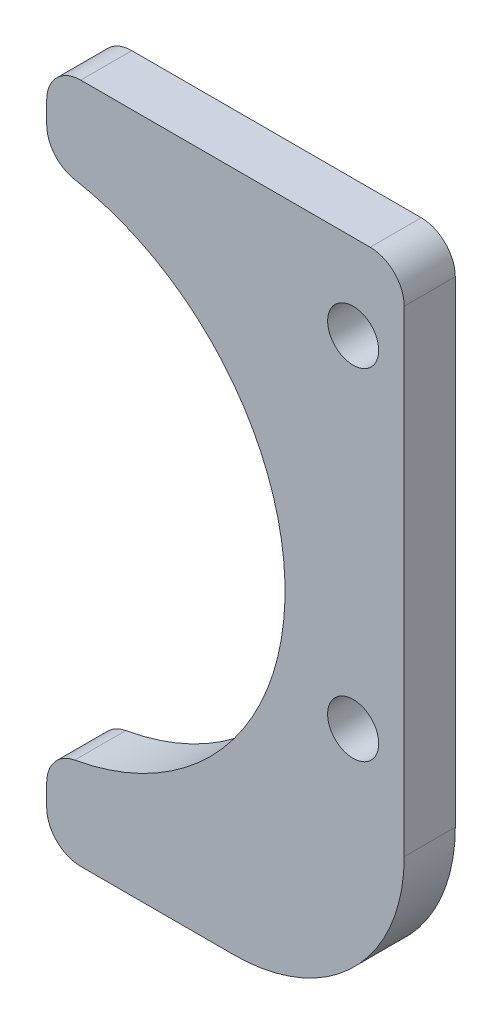
from build123d import *

# Parameters (mm, degrees)
EXTRUDE_1_DEPTH     = 3
SKETCH_2_R          = 1.5
CUT_EXTRUDE_1_DEPTH = 30.883105595
FILLET_1_R          = 10
FILLET_2_R          = 2


with BuildPart() as part:
    # 草图1 → 凸台-拉伸1 (new body)
    with BuildSketch(Plane.XY):
        with BuildLine():
            Line((22, 20), (22, -20))
            Line((22, -20), (1, -20))
            Line((1, -20), (1, -14.966629547))
            ThreePointArc((1, -14.966629547), (15, 0), (1, 14.966629547))
            Line((1, 14.966629547), (1, 20))
            Line((1, 20), (22, 20))
        make_face()
    extrude(amount=EXTRUDE_1_DEPTH)

    # 草图2 → 切除-拉伸1 (cut, through all)
    with BuildSketch(Plane.XY.offset(3)):
        with Locations((19, 15)):
            Circle(SKETCH_2_R)
        with Locations((19, -5)):
            Circle(SKETCH_2_R)
    extrude(amount=-CUT_EXTRUDE_1_DEPTH, mode=Mode.SUBTRACT)

    # 圆角1
    fillet_1_edges = [part.edges().sort_by_distance(p)[0] for p in [
        (22, -20, 1.5),
    ]]
    fillet(fillet_1_edges, radius=FILLET_1_R)

    # 圆角2
    fillet_2_edges = [part.edges().sort_by_distance(p)[0] for p in [
        (1, 20, 1.5),
        (22, 20, 1.5),
        (1, -20, 1.5),
        (1, -14.966629547, 1.5),
        (1, 14.966629547, 1.5),
    ]]
    fillet(fillet_2_edges, radius=FILLET_2_R)


solid = part.part
